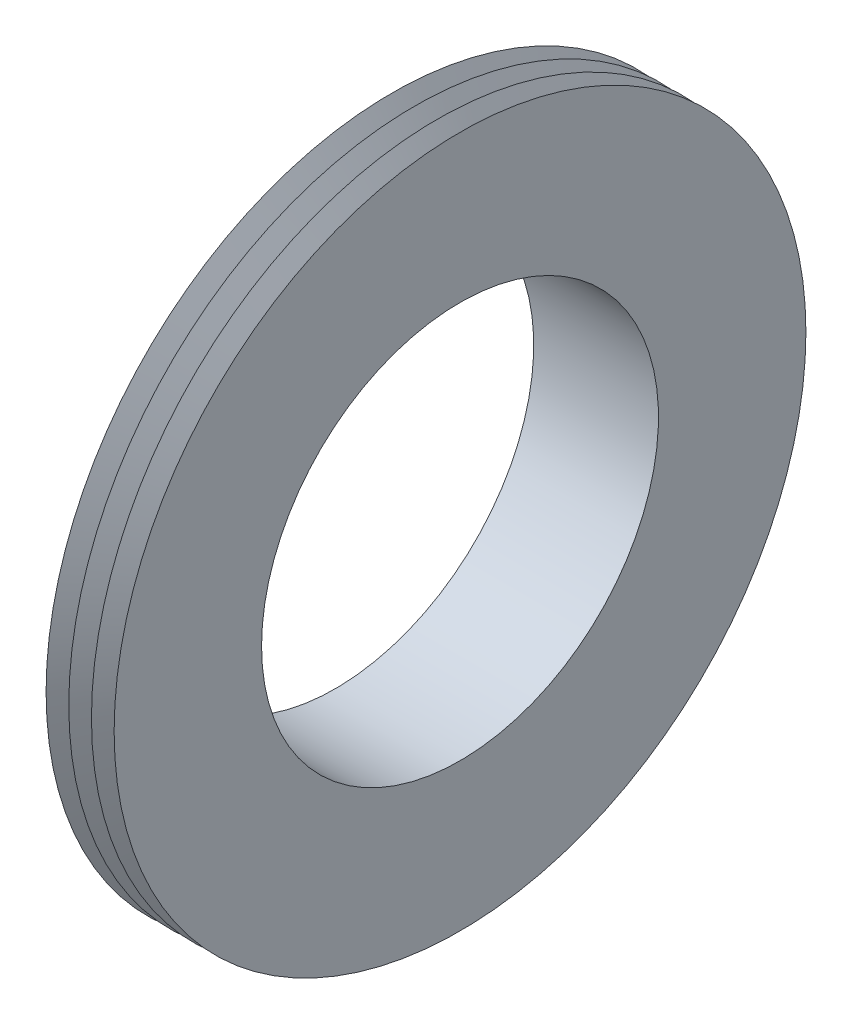
from build123d import *


with BuildPart() as part:
    # 草图1 → 旋转1 (revolve)
    with BuildSketch(Plane.XY, mode=Mode.PRIVATE) as revolve_1_sk:
        Polygon((0, 17.5), (11, 17.5), (11, 30.5), (10, 28.767949192), (9, 30.5), (8, 28.767949192), (7, 30.5), (6, 28.767949192), (5, 30.5), (5, 21.5), (0, 21.5), align=None)
    revolve(revolve_1_sk.sketch.rotate(Axis((0, 0, 0), (1, 0, 0)), 90), axis=Axis((0, 0, 0), (1, 0, 0)))


solid = part.part
